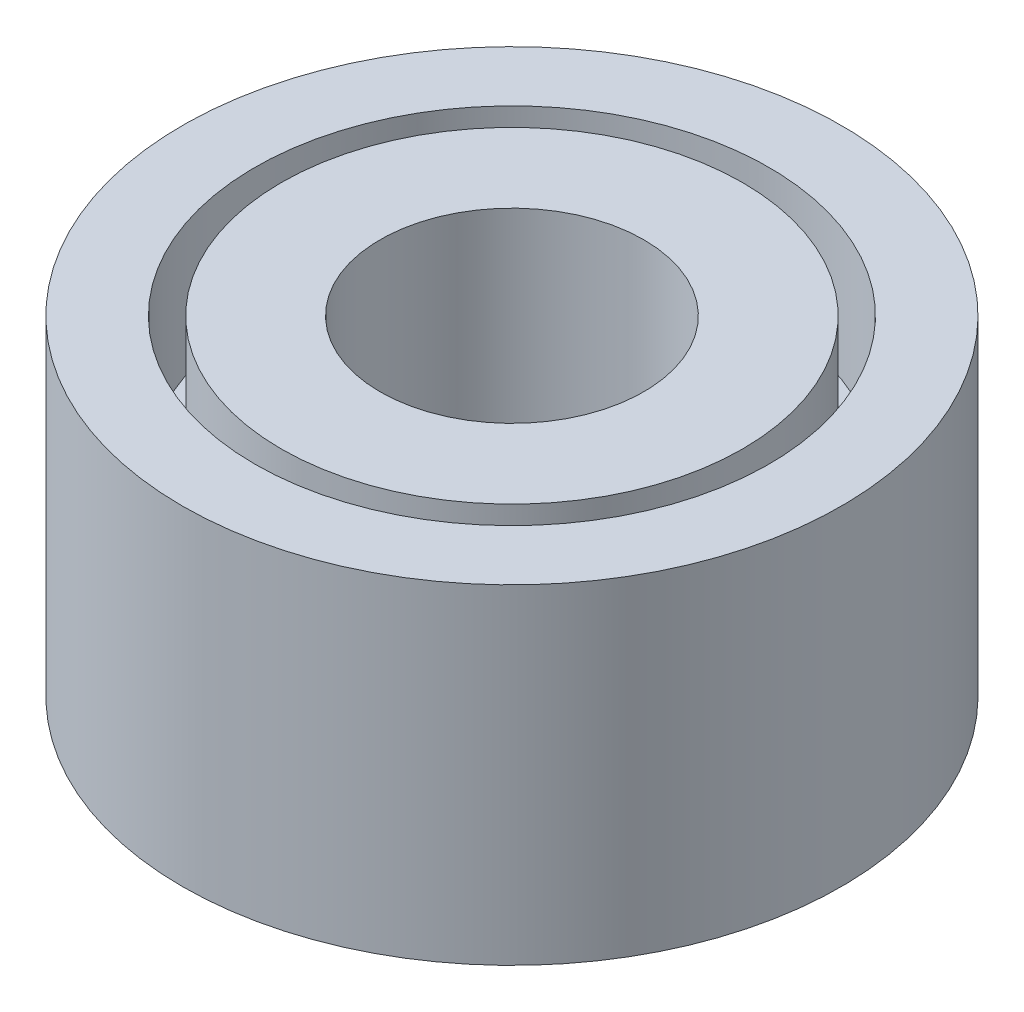
from build123d import *

# Parameters (mm, degrees)
SKETCH_1_R          = 2.5
SKETCH_1_R_2        = 1
EXTRUDE_1_DEPTH     = 2.5
SKETCH_1_3_R        = 1.95
SKETCH_1_3_R_2      = 1.75
CUT_EXTRUDE_1_DEPTH = 1
CUT_EXTRUDE_START   = 1.5
SKETCH_1_4_R        = 1.95
SKETCH_1_4_R_2      = 1.75
CUT_EXTRUDE_2_DEPTH = 1


with BuildPart() as part:
    # 草图1 → 凸台-拉伸1 (new body)
    with BuildSketch(Plane(origin=(0, 0, 0), x_dir=(1, 0, 0), z_dir=(0, 1, 0))):
        with Locations(Location((0, 0, 0), (0, 0, 270))):
            Circle(SKETCH_1_R)
        with Locations(Location((0, 0, 0), (0, 0, 270))):
            Circle(SKETCH_1_R_2, mode=Mode.SUBTRACT)
    extrude(amount=EXTRUDE_1_DEPTH)

    # 草图1<3> → 切除-拉伸-薄壁1 (cut)
    with BuildSketch(Plane(origin=(0, 0, 0), x_dir=(1, 0, 0), z_dir=(0, 1, 0))):
        Circle(SKETCH_1_3_R)
        Circle(SKETCH_1_3_R_2, mode=Mode.SUBTRACT)
    extrude(amount=CUT_EXTRUDE_1_DEPTH, mode=Mode.SUBTRACT)

    # 草图1<4> → 切除-拉伸-薄壁2 (cut)
    with BuildSketch(Plane(origin=(0, 0, 0), x_dir=(1, 0, 0), z_dir=(0, 1, 0)).offset(CUT_EXTRUDE_START)):
        Circle(SKETCH_1_4_R)
        Circle(SKETCH_1_4_R_2, mode=Mode.SUBTRACT)
    extrude(amount=CUT_EXTRUDE_2_DEPTH, mode=Mode.SUBTRACT)


solid = part.part
